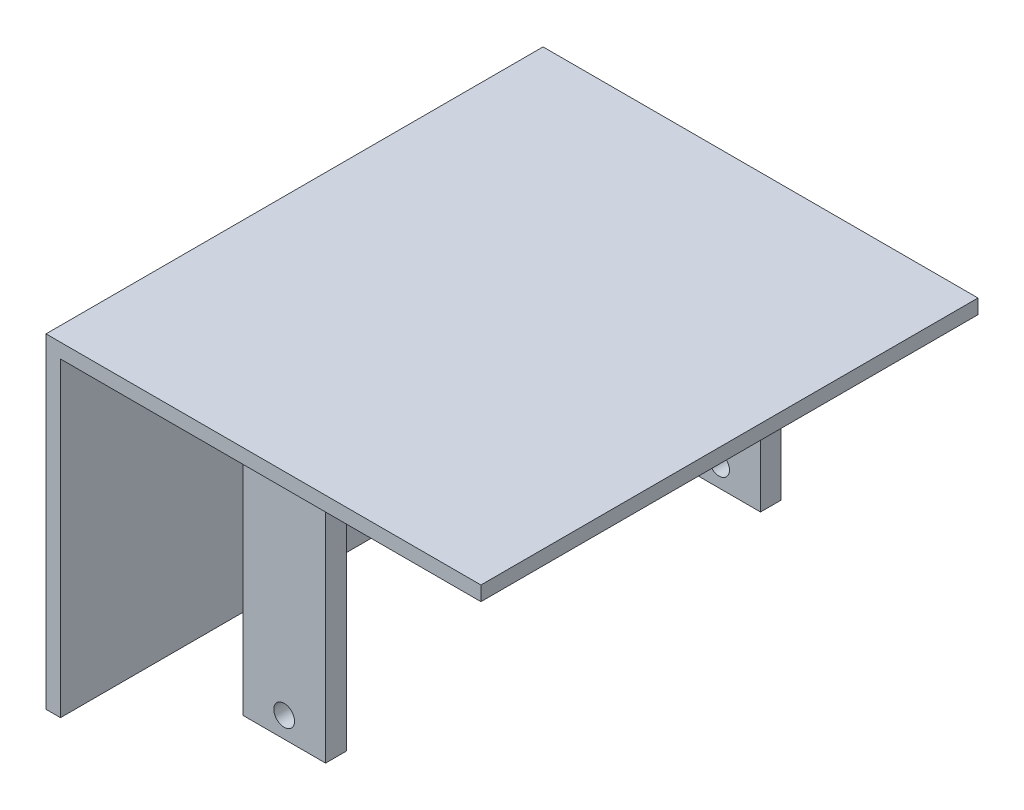
from build123d import *

# Parameters (mm, degrees)
SKETCH2_W               = 533.4
SKETCH2_H               = 609.6
SKETCH2_W_2             = 101.6
SKETCH2_H_2             = 25.4
BOSS_EXTRUDE1_DEPTH     = 17.78
SKETCH3_W               = 101.6
SKETCH3_H               = 25.4
BOSS_EXTRUDE2_DEPTH     = 17.78
SKETCH3_2_W             = 101.6
SKETCH3_2_H             = 25.4
BOSS_EXTRUDE3_DEPTH     = 292.1
CUT_EXTRUDE1_DEPTH      = 508
CUT_EXTRUDE1_DEPTH_BACK = 508
SKETCH4_R               = 12.7
SKETCH5_W               = 17.78
SKETCH5_H               = 609.6
BOSS_EXTRUDE4_DEPTH     = 381


with BuildPart() as part:
    # Sketch2 → Boss-Extrude1 (new body)
    with BuildSketch(Plane(origin=(0, 0, 0), x_dir=(1, 0, 0), z_dir=(0, 1, 0))):
        Rectangle(SKETCH2_W, SKETCH2_H)
        with Locations((0, -266.7)):
            Rectangle(SKETCH2_W_2, SKETCH2_H_2, mode=Mode.SUBTRACT)
        with Locations((0, 266.7)):
            Rectangle(SKETCH2_W_2, SKETCH2_H_2, mode=Mode.SUBTRACT)
    extrude(amount=BOSS_EXTRUDE1_DEPTH)

    # Sketch3 → Boss-Extrude2 (add)
    with BuildSketch(Plane(origin=(0, 0, 0), x_dir=(1, 0, 0), z_dir=(0, 1, 0))):
        with Locations((0, -266.7)):
            Rectangle(SKETCH3_W, SKETCH3_H)
        with Locations((0, 266.7)):
            Rectangle(SKETCH3_W, SKETCH3_H)
    extrude(amount=BOSS_EXTRUDE2_DEPTH)

    # Sketch3<2> → Boss-Extrude3 (add)
    with BuildSketch(Plane(origin=(0, 0, 0), x_dir=(1, 0, 0), z_dir=(0, 1, 0))):
        with Locations((0, -266.7)):
            Rectangle(SKETCH3_2_W, SKETCH3_2_H)
        with Locations((0, 266.7)):
            Rectangle(SKETCH3_2_W, SKETCH3_2_H)
    extrude(amount=-BOSS_EXTRUDE3_DEPTH)

    # Sketch4 → Cut-Extrude1 (cut, two sides: drawn at the far end of the back side and taken through both)
    with BuildSketch(Plane.XY.offset(-CUT_EXTRUDE1_DEPTH_BACK)):
        with Locations((0, -266.7)):
            Circle(SKETCH4_R)
    extrude(amount=CUT_EXTRUDE1_DEPTH + CUT_EXTRUDE1_DEPTH_BACK, mode=Mode.SUBTRACT)

    # Sketch5 → Boss-Extrude4 (add)
    with BuildSketch(Plane(origin=(0, 0, 0), x_dir=(1, 0, 0), z_dir=(0, 1, 0))):
        with Locations((-257.81, 0)):
            Rectangle(SKETCH5_W, SKETCH5_H)
    extrude(amount=-BOSS_EXTRUDE4_DEPTH)


solid = part.part
